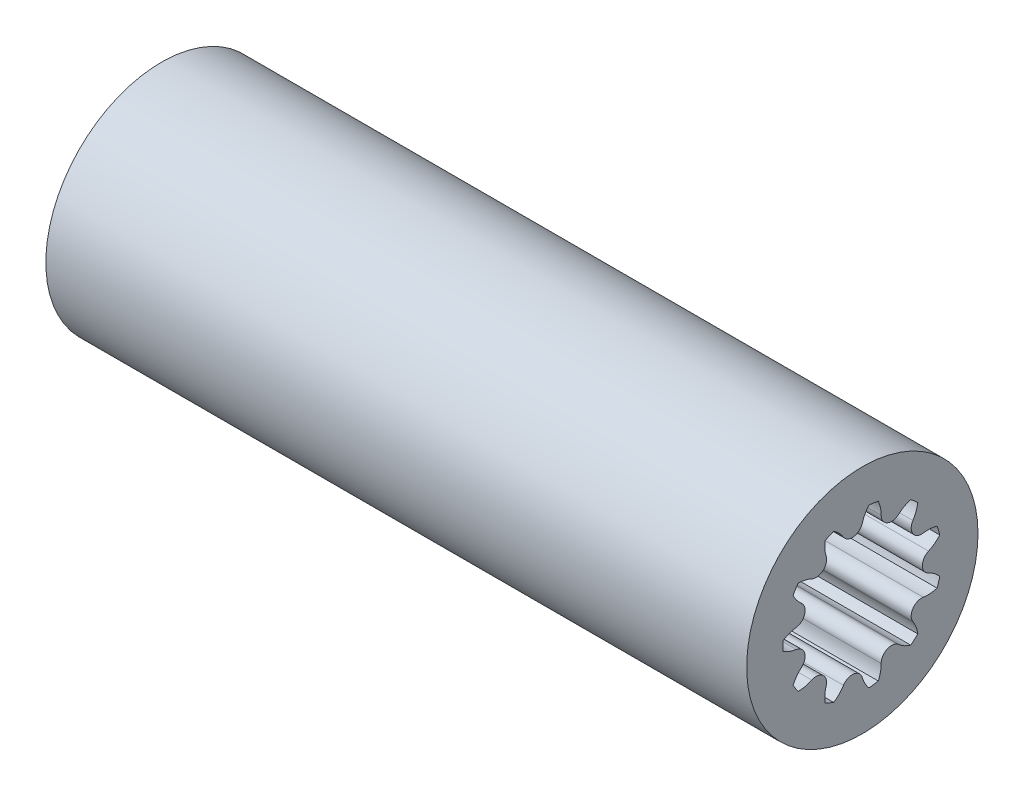
from build123d import *

# Parameters (mm, degrees)
SKETCH1_R           = 5.5
BOSS_EXTRUDE1_DEPTH = 14
SKETCH2_R           = 5.5
BOSS_EXTRUDE2_DEPTH = 13.52
SKETCH3_R           = 5.5
BOSS_EXTRUDE3_DEPTH = 5.8
SKETCH4_R           = 1.05
CUT_EXTRUDE1_DEPTH  = 3.5


with BuildPart() as part:
    # Sketch1 → Boss-Extrude1 (new body)
    with BuildSketch(Plane.YZ):
        with Locations(Location((0, 0, 0), (0, 0, 270))):
            Circle(SKETCH1_R)
        with BuildLine():
            Line((-1.747140521, 2.5), (1.747140521, 2.5))
            ThreePointArc((1.747140521, 2.5), (0, -3.05), (-1.747140521, 2.5))
        make_face(mode=Mode.SUBTRACT)
    extrude(amount=BOSS_EXTRUDE1_DEPTH)

    # Sketch2 → Boss-Extrude2 (add)
    with BuildSketch(Plane.YZ.offset(14)):
        with Locations(Location((0, 0, 0), (0, 0, 270))):
            Circle(SKETCH2_R)
    extrude(amount=BOSS_EXTRUDE2_DEPTH)

    # Sketch3 → Boss-Extrude3 (add)
    with BuildSketch(Plane.YZ.offset(27.52)):
        with Locations(Location((0, 0, 0), (0, 0, 270))):
            Circle(SKETCH3_R)
        with BuildLine():
            ThreePointArc((-1.322019746, -2.893008891), (-1.318956528, -2.868853063), (-1.317084788, -2.844575833))
            ThreePointArc((-1.317084788, -2.844575833), (-1.543809469, -2.402214423), (-2.040380396, -2.37974197))
            ThreePointArc((-2.040380396, -2.37974197), (-2.061686193, -2.391529691), (-2.0823866, -2.404350785))
            ThreePointArc((-2.0823866, -2.404350785), (-2.380259348, -2.555545236), (-2.703854763, -2.638454478))
            ThreePointArc((-2.703854763, -2.638454478), (-2.855120731, -2.473976197), (-2.996397469, -2.300842198))
            ThreePointArc((-2.996397469, -2.300842198), (-2.868279694, -1.992339732), (-2.676232473, -1.719016114))
            ThreePointArc((-2.676232473, -1.719016114), (-2.660595904, -1.700351039), (-2.645896034, -1.680939672))
            ThreePointArc((-2.645896034, -1.680939672), (-2.597470339, -1.186224957), (-3.003062861, -0.898853414))
            ThreePointArc((-3.003062861, -0.898853414), (-3.02735936, -0.897251093), (-3.051705258, -0.896845399))
            ThreePointArc((-3.051705258, -0.896845399), (-3.384033651, -0.862996099), (-3.701083558, -0.757794901))
            ThreePointArc((-3.701083558, -0.757794901), (-3.739412915, -0.537646409), (-3.764659163, -0.315616851))
            ThreePointArc((-3.764659163, -0.315616851), (-3.490090608, -0.12535376), (-3.1807603, 0.000752133))
            ThreePointArc((-3.1807603, 0.000752133), (-3.157514879, 0.008000426), (-3.134653985, 0.016382957))
            ThreePointArc((-3.134653985, 0.016382957), (-2.82645273, 0.406382552), (-3.012294086, 0.86741475))
            ThreePointArc((-3.012294086, 0.86741475), (-3.031867321, 0.881898388), (-3.052129059, 0.895402065))
            ThreePointArc((-3.052129059, 0.895402065), (-3.31340118, 1.103548202), (-3.523244473, 1.363459202))
            ThreePointArc((-3.523244473, 1.363459202), (-3.43646792, 1.569382314), (-3.337668173, 1.769814617))
            ThreePointArc((-3.337668173, 1.769814617), (-3.003822413, 1.781431146), (-2.675419206, 1.720281583))
            ThreePointArc((-2.675419206, 1.720281583), (-2.65194519, 1.713811812), (-2.628181444, 1.708504114))
            ThreePointArc((-2.628181444, 1.708504114), (-2.158056349, 1.869966471), (-2.065143222, 2.35828486))
            ThreePointArc((-2.065143222, 2.35828486), (-2.07377883, 2.381051361), (-2.083523449, 2.4033657))
            ThreePointArc((-2.083523449, 2.4033657), (-2.190787246, 2.719723746), (-2.226800162, 3.051824643))
            ThreePointArc((-2.226800162, 3.051824643), (-2.042468641, 3.178143241), (-1.850991121, 3.293342448))
            ThreePointArc((-1.850991121, 3.293342448), (-1.563861826, 3.12262425), (-1.320651417, 2.893633786))
            ThreePointArc((-1.320651417, 2.893633786), (-1.304401641, 2.875500057), (-1.287279864, 2.858187286))
            ThreePointArc((-1.287279864, 2.858187286), (-0.804492326, 2.739849249), (-0.462323977, 3.100416189))
            ThreePointArc((-0.462323977, 3.100416189), (-0.457280213, 3.124237351), (-0.453413865, 3.148277707))
            ThreePointArc((-0.453413865, 3.148277707), (-0.372613841, 3.472406218), (-0.223362534, 3.771257322))
            ThreePointArc((-0.223362534, 3.771257322), (-0.111730141, 3.776213578), (0, 3.777866145))
            ThreePointArc((0, 3.777866145), (0.111730141, 3.776213578), (0.223362534, 3.771257322))
            ThreePointArc((0.223362534, 3.771257322), (0.372613841, 3.472406218), (0.453413865, 3.148277707))
            ThreePointArc((0.453413865, 3.148277707), (0.457280213, 3.124237351), (0.462323977, 3.100416189))
            ThreePointArc((0.462323977, 3.100416189), (0.804492326, 2.739849249), (1.287279864, 2.858187286))
            ThreePointArc((1.287279864, 2.858187286), (1.304401641, 2.875500057), (1.320651417, 2.893633786))
            ThreePointArc((1.320651417, 2.893633786), (1.563861826, 3.12262425), (1.850991121, 3.293342448))
            ThreePointArc((1.850991121, 3.293342448), (2.042468641, 3.178143241), (2.226800162, 3.051824643))
            ThreePointArc((2.226800162, 3.051824643), (2.190787246, 2.719723746), (2.083523449, 2.4033657))
            ThreePointArc((2.083523449, 2.4033657), (2.07377883, 2.381051361), (2.065143222, 2.35828486))
            ThreePointArc((2.065143222, 2.35828486), (2.158056349, 1.869966471), (2.628181444, 1.708504114))
            ThreePointArc((2.628181444, 1.708504114), (2.65194519, 1.713811812), (2.675419206, 1.720281583))
            ThreePointArc((2.675419206, 1.720281583), (3.003822413, 1.781431146), (3.337668173, 1.769814617))
            ThreePointArc((3.337668173, 1.769814617), (3.43646792, 1.569382314), (3.523244473, 1.363459202))
            ThreePointArc((3.523244473, 1.363459202), (3.31340118, 1.103548202), (3.052129059, 0.895402065))
            ThreePointArc((3.052129059, 0.895402065), (3.031867321, 0.881898388), (3.012294086, 0.86741475))
            ThreePointArc((3.012294086, 0.86741475), (2.82645273, 0.406382552), (3.134653985, 0.016382957))
            ThreePointArc((3.134653985, 0.016382957), (3.157514879, 0.008000426), (3.1807603, 0.000752133))
            ThreePointArc((3.1807603, 0.000752133), (3.490090608, -0.12535376), (3.764659163, -0.315616851))
            ThreePointArc((3.764659163, -0.315616851), (3.739412915, -0.537646409), (3.701083558, -0.757794901))
            ThreePointArc((3.701083558, -0.757794901), (3.384033651, -0.862996099), (3.051705258, -0.896845399))
            ThreePointArc((3.051705258, -0.896845399), (3.02735936, -0.897251093), (3.003062861, -0.898853414))
            ThreePointArc((3.003062861, -0.898853414), (2.597470339, -1.186224957), (2.645896034, -1.680939672))
            ThreePointArc((2.645896034, -1.680939672), (2.660595904, -1.700351039), (2.676232473, -1.719016114))
            ThreePointArc((2.676232473, -1.719016114), (2.868279694, -1.992339732), (2.996397469, -2.300842198))
            ThreePointArc((2.996397469, -2.300842198), (2.855120731, -2.473976197), (2.703854763, -2.638454478))
            ThreePointArc((2.703854763, -2.638454478), (2.380259349, -2.555545235), (2.082386604, -2.404350784))
            ThreePointArc((2.082386604, -2.404350784), (2.061686196, -2.39152969), (2.0403804, -2.379741969))
            ThreePointArc((2.0403804, -2.379741969), (1.54380947, -2.402214422), (1.317084788, -2.844575834))
            ThreePointArc((1.317084788, -2.844575834), (1.318956528, -2.868853064), (1.322019746, -2.893008892))
            ThreePointArc((1.322019746, -2.893008892), (1.335810244, -3.226771918), (1.27680075, -3.555566405))
            ThreePointArc((1.27680075, -3.555566405), (1.064347889, -3.624836022), (0.848171186, -3.6814234))
            ThreePointArc((0.848171186, -3.6814234), (0.62076952, -3.436726817), (0.45192491, -3.148491786))
            ThreePointArc((0.45192491, -3.148491786), (0.441442226, -3.12651451), (0.429891573, -3.105079266))
            ThreePointArc((0.429891573, -3.105079266), (0, -2.855517783), (-0.429891573, -3.105079265))
            ThreePointArc((-0.429891573, -3.105079265), (-0.441442226, -3.12651451), (-0.45192491, -3.148491786))
            ThreePointArc((-0.45192491, -3.148491786), (-0.62076952, -3.436726817), (-0.848171186, -3.6814234))
            ThreePointArc((-0.848171186, -3.6814234), (-1.064347889, -3.624836022), (-1.27680075, -3.555566405))
            ThreePointArc((-1.27680075, -3.555566405), (-1.335810244, -3.226771917), (-1.322019746, -2.893008891))
        make_face(mode=Mode.SUBTRACT)
    extrude(amount=BOSS_EXTRUDE3_DEPTH)

    # Sketch4 → Cut-Extrude1 (cut)
    with BuildSketch(Plane.YZ.offset(27.52)):
        with Locations(Location((0, 0, 0), (0, 0, 270))):
            Circle(SKETCH4_R)
    extrude(amount=-CUT_EXTRUDE1_DEPTH, mode=Mode.SUBTRACT)


solid = part.part
